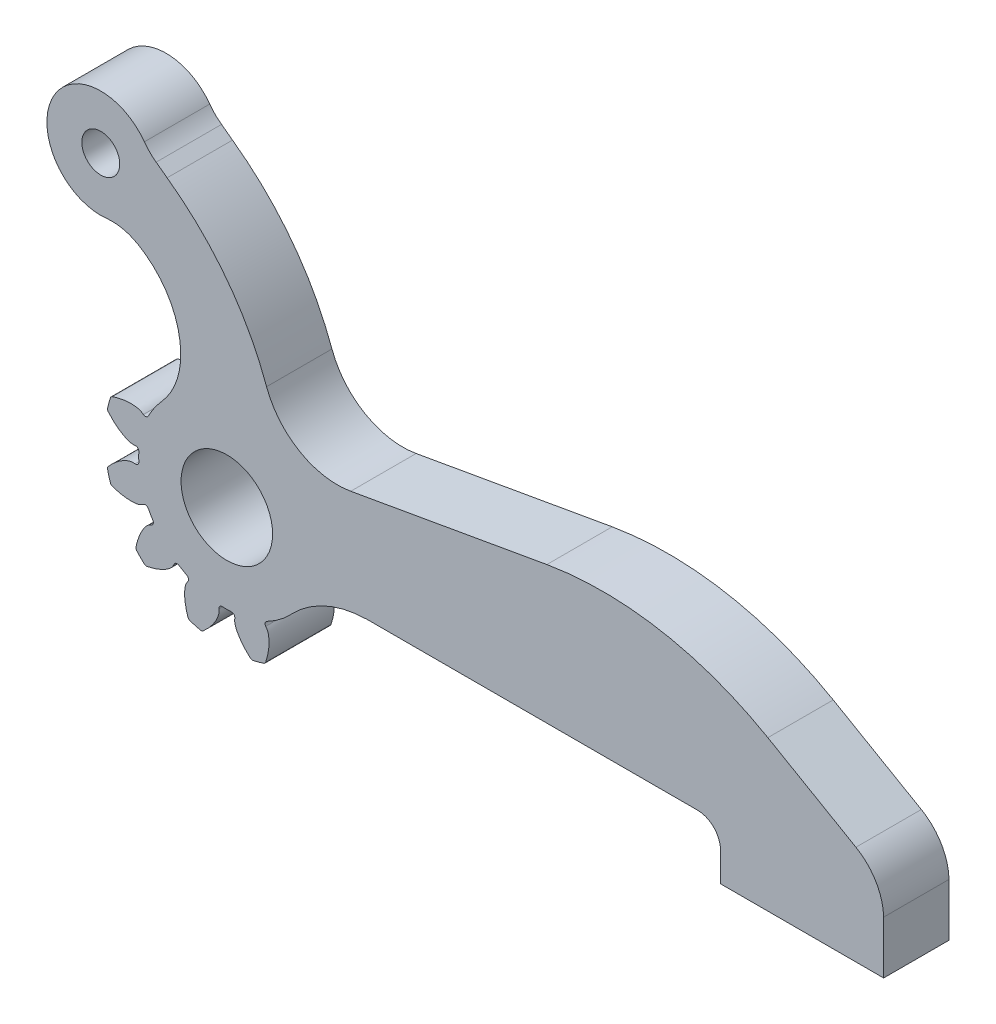
from build123d import *

# Parameters (mm, degrees)
ESQUISSE1_R        = 3.5
ESQUISSE1_R_2      = 1.45
BOSS_EXTRU_1_DEPTH = 5


with BuildPart() as part:
    # Esquisse1 → Boss.-Extru.1 (new body)
    with BuildSketch(Plane.XY):
        with BuildLine():
            Line((-23.520309347, 11.085383373), (-24.358908183, 11.706502475))
            ThreePointArc((-24.358908183, 11.706502475), (-24.845678879, 12.118284674), (-25.260449538, 12.602511471))
            ThreePointArc((-25.260449538, 12.602511471), (-32.357200459, 11.85890316), (-28.166092976, 6.083832163))
            ThreePointArc((-28.166092976, 6.083832163), (-26.925251175, 6.018420638), (-25.765053202, 5.573552451))
            ThreePointArc((-25.765053202, 5.573552451), (-23.38866031, 3.221956107), (-22.477205459, 0.005358743))
            ThreePointArc((-22.477205459, 0.005358743), (-22.840333933, -2.118823087), (-23.958742219, -3.960879992))
            ThreePointArc((-23.958742219, -3.960879992), (-24.504417424, -4.651802838), (-24.955377519, -5.407958113))
            ThreePointArc((-24.955377519, -5.407958113), (-25.122929262, -5.539522919), (-25.331723523, -5.497240048))
            add(Edge.make_bspline(
                [(-27.707778762, -5.50497209), (-27.463755153, -5.421858651), (-27.208964141, -5.35321212), (-26.847281922, -5.290646334), (-26.755999287, -5.277514723), (-26.472348923, -5.247412771), (-26.276940328, -5.237520804), (-25.988433148, -5.260972525), (-25.921846007, -5.267964485), (-25.794475247, -5.289589568), (-25.737903956, -5.299827616), (-25.600175401, -5.340785914), (-25.51525962, -5.375688947), (-25.386655187, -5.458237644), (-25.359770306, -5.476681289), (-25.331723523, -5.497240048)],
                knots=[0, 0, 0, 0, 0.401379624, 0.401379624, 0.532597126, 0.532597126, 0.795032129, 0.795032129, 0.872293172, 0.872293172, 0.929035383, 0.929035383, 0.985777595, 0.985777595, 1, 1, 1, 1], degree=3))
            ThreePointArc((-27.707778762, -5.50497209), (-27.801973044, -5.564338041), (-27.859240924, -5.659822431))
            ThreePointArc((-27.859240924, -5.659822431), (-27.97528469, -6.057416591), (-28.073587363, -6.459764521))
            ThreePointArc((-28.073587363, -6.459764521), (-28.071734795, -6.57109038), (-28.019843727, -6.669600257))
            add(Edge.make_bspline(
                [(-25.965992802, -7.864336487), (-26.163909603, -7.885982848), (-26.294618647, -7.863685821), (-26.490123672, -7.810689646), (-26.569333075, -7.776803309), (-26.723621302, -7.70842793), (-26.794279204, -7.672573545), (-27.014611477, -7.551431096), (-27.148381506, -7.461400071), (-27.399282552, -7.274477346), (-27.514428456, -7.1774816), (-27.765918403, -6.946352168), (-27.896967937, -6.810004535), (-28.019843727, -6.669600257)],
                knots=[0, 0, 0, 0, 0.081187854, 0.081187854, 0.177126147, 0.177126147, 0.27306444, 0.27306444, 0.491378598, 0.491378598, 0.709692757, 0.709692757, 1, 1, 1, 1], degree=3))
            ThreePointArc((-25.965992802, -7.864336487), (-25.764030643, -7.932116803), (-25.68471018, -8.12983162))
            ThreePointArc((-25.68471018, -8.12983162), (-25.693544809, -8.474793397), (-25.684712274, -8.819755228))
            ThreePointArc((-25.684712274, -8.819755228), (-25.764033937, -9.017469563), (-25.965996507, -9.085248653))
            add(Edge.make_bspline(
                [(-28.019854683, -10.279972417), (-27.850080758, -10.085982263), (-27.663748533, -9.899137116), (-27.381805435, -9.664112445), (-27.309318159, -9.607098819), (-27.078720715, -9.439204582), (-26.914437891, -9.332933591), (-26.652857483, -9.208989788), (-26.591695348, -9.181751432), (-26.470576489, -9.136793922), (-26.416465288, -9.117374686), (-26.2767097, -9.083981334), (-26.185718951, -9.071750358), (-26.033069896, -9.078937415), (-26.000565097, -9.081467639), (-25.965996507, -9.085248653)],
                knots=[0, 0, 0, 0, 0.401379627, 0.401379627, 0.532597128, 0.532597128, 0.79503213, 0.79503213, 0.872293173, 0.872293173, 0.929035387, 0.929035387, 0.985777601, 0.985777601, 1, 1, 1, 1], degree=3))
            ThreePointArc((-28.019854683, -10.279972417), (-28.071746349, -10.37848198), (-28.073599593, -10.489807828))
            ThreePointArc((-28.073599593, -10.489807828), (-27.975299362, -10.892156354), (-27.85925801, -11.289751218))
            ThreePointArc((-27.85925801, -11.289751218), (-27.801990645, -11.385236021), (-27.707796615, -11.444602537))
            add(Edge.make_bspline(
                [(-25.331741596, -11.452348942), (-25.492319392, -11.570053641), (-25.616665259, -11.616098371), (-25.812475663, -11.66795485), (-25.898016186, -11.678213122), (-26.065821398, -11.696142421), (-26.144940129, -11.700420563), (-26.396324695, -11.705674262), (-26.557188449, -11.694590122), (-26.867936486, -11.658160819), (-27.016153634, -11.631732992), (-27.349515039, -11.557314005), (-27.531181086, -11.504758257), (-27.707796615, -11.444602537)],
                knots=[0, 0, 0, 0, 0.081187854, 0.081187854, 0.177126146, 0.177126146, 0.273064438, 0.273064438, 0.491378592, 0.491378592, 0.709692747, 0.709692747, 1, 1, 1, 1], degree=3))
            ThreePointArc((-25.331741596, -11.452348942), (-25.122947078, -11.410067338), (-24.955396133, -11.541633161))
            ThreePointArc((-24.955396133, -11.541633161), (-24.790566257, -11.844796137), (-24.610436143, -12.139125579))
            ThreePointArc((-24.610436143, -12.139125579), (-24.58027355, -12.350012048), (-24.721288721, -12.509691746))
            add(Edge.make_bspline(
                [(-25.902620196, -14.571281964), (-25.852586741, -14.318394602), (-25.784640874, -14.063415847), (-25.657983326, -13.718906965), (-25.623714317, -13.633288078), (-25.50795819, -13.372588681), (-25.418820586, -13.19841389), (-25.254257211, -12.960285204), (-25.214908427, -12.906115029), (-25.132495175, -12.806621255), (-25.095343118, -12.762748102), (-24.991007907, -12.663950818), (-24.918323098, -12.607863109), (-24.78253161, -12.537762753), (-24.753116511, -12.52370159), (-24.721288721, -12.509691746)],
                knots=[0, 0, 0, 0, 0.401379624, 0.401379624, 0.532597126, 0.532597126, 0.795032129, 0.795032129, 0.872293171, 0.872293171, 0.929035385, 0.929035385, 0.985777599, 0.985777599, 1, 1, 1, 1], degree=3))
            ThreePointArc((-25.902620196, -14.571281964), (-25.898304915, -14.682539581), (-25.844246948, -14.779877216))
            ThreePointArc((-25.844246948, -14.779877216), (-25.557942188, -15.079171145), (-25.258649996, -15.365477722))
            ThreePointArc((-25.258649996, -15.365477722), (-25.16131269, -15.41953628), (-25.0500551, -15.423852235))
            add(Edge.make_bspline(
                [(-22.988457711, -14.242533274), (-23.068669813, -14.424757432), (-23.153334128, -14.526806272), (-23.296982674, -14.669620503), (-23.365933805, -14.72127469), (-23.502292735, -14.820704525), (-23.568672495, -14.863968871), (-23.783751076, -14.994210996), (-23.928605252, -15.065043729), (-24.215935615, -15.188869049), (-24.357509352, -15.240090455), (-24.683418279, -15.342322416), (-24.867023546, -15.387640821), (-25.0500551, -15.423852235)],
                knots=[0, 0, 0, 0, 0.081187854, 0.081187854, 0.177126148, 0.177126148, 0.273064442, 0.273064442, 0.49137861, 0.49137861, 0.709692777, 0.709692777, 1, 1, 1, 1], degree=3))
            ThreePointArc((-22.988457711, -14.242533274), (-22.828777157, -14.101519072), (-22.617890871, -14.131682944))
            ThreePointArc((-22.617890871, -14.131682944), (-22.323562523, -14.311814845), (-22.020400547, -14.476646561))
            ThreePointArc((-22.020400547, -14.476646561), (-21.88883574, -14.644198304), (-21.931118612, -14.852992566))
            add(Edge.make_bspline(
                [(-21.92338657, -17.229047804), (-22.006500009, -16.985024196), (-22.075146539, -16.730233184), (-22.137712326, -16.368550965), (-22.150843937, -16.27726833), (-22.180945889, -15.993617965), (-22.190837855, -15.798209371), (-22.167386135, -15.509702191), (-22.160394175, -15.44311505), (-22.138769092, -15.315744289), (-22.128531044, -15.259172998), (-22.087572745, -15.121444441), (-22.052669711, -15.036528659), (-21.970121013, -14.907924226), (-21.951677369, -14.881039346), (-21.931118612, -14.852992566)],
                knots=[0, 0, 0, 0, 0.401379624, 0.401379624, 0.532597126, 0.532597126, 0.795032129, 0.795032129, 0.872293171, 0.872293171, 0.929035384, 0.929035384, 0.985777596, 0.985777596, 1, 1, 1, 1], degree=3))
            ThreePointArc((-21.92338657, -17.229047804), (-21.864020619, -17.323242086), (-21.768536229, -17.380509967))
            ThreePointArc((-21.768536229, -17.380509967), (-21.370942069, -17.496553733), (-20.96859414, -17.594856406))
            ThreePointArc((-20.96859414, -17.594856406), (-20.85726828, -17.593003837), (-20.758758403, -17.541112769))
            add(Edge.make_bspline(
                [(-19.564022173, -15.487261844), (-19.542375812, -15.685178645), (-19.564672839, -15.815887691), (-19.617669014, -16.011392715), (-19.651555352, -16.090602119), (-19.719930731, -16.244890347), (-19.755785117, -16.31554825), (-19.87692757, -16.535880531), (-19.9669586, -16.669650565), (-20.153881335, -16.920551621), (-20.250877086, -17.035697529), (-20.482006514, -17.287187467), (-20.618354136, -17.418236989), (-20.758758403, -17.541112769)],
                knots=[0, 0, 0, 0, 0.081187854, 0.081187854, 0.177126148, 0.177126148, 0.273064442, 0.273064442, 0.491378611, 0.491378611, 0.70969278, 0.70969278, 1, 1, 1, 1], degree=3))
            ThreePointArc((-19.564022173, -15.487261844), (-19.496241857, -15.285299686), (-19.29852704, -15.205979223))
            ThreePointArc((-19.29852704, -15.205979223), (-18.953565263, -15.214813851), (-18.608603432, -15.205981317))
            ThreePointArc((-18.608603432, -15.205981317), (-18.410889097, -15.285302979), (-18.343110007, -15.48726555))
            add(Edge.make_bspline(
                [(-17.148386243, -17.541123726), (-17.342376397, -17.3713498), (-17.529221544, -17.185017576), (-17.764246214, -16.903074479), (-17.82125984, -16.830587203), (-17.989154077, -16.599989758), (-18.095425068, -16.435706934), (-18.219368872, -16.174126527), (-18.246607228, -16.112964392), (-18.291564738, -15.991845532), (-18.310983975, -15.93773433), (-18.344377327, -15.797978738), (-18.356608302, -15.706987985), (-18.349421244, -15.554338929), (-18.34689102, -15.521834135), (-18.343110007, -15.48726555)],
                knots=[0, 0, 0, 0, 0.401379626, 0.401379626, 0.532597128, 0.532597128, 0.79503213, 0.79503213, 0.872293172, 0.872293172, 0.929035388, 0.929035388, 0.985777604, 0.985777604, 1, 1, 1, 1], degree=3))
            ThreePointArc((-17.148386243, -17.541123726), (-17.04987668, -17.593015392), (-16.938550832, -17.594868636))
            ThreePointArc((-16.938550832, -17.594868636), (-16.536202306, -17.496568405), (-16.138607442, -17.380527052))
            ThreePointArc((-16.138607442, -17.380527052), (-16.043122704, -17.323259752), (-15.983756182, -17.22906583))
            add(Edge.make_bspline(
                [(-15.976009718, -14.853010638), (-15.858305019, -15.013588435), (-15.812260288, -15.137934302), (-15.76040381, -15.333744708), (-15.750145537, -15.419285233), (-15.732216239, -15.587090447), (-15.727938096, -15.666209179), (-15.722684398, -15.917593753), (-15.733768539, -16.078457512), (-15.770197846, -16.38920556), (-15.796625675, -16.537422713), (-15.871044662, -16.870784108), (-15.923600407, -17.052450142), (-15.983756182, -17.22906583)],
                knots=[0, 0, 0, 0, 0.081187854, 0.081187854, 0.177126148, 0.177126148, 0.273064442, 0.273064442, 0.491378605, 0.491378605, 0.709692768, 0.709692768, 1, 1, 1, 1], degree=3))
            ThreePointArc((-15.976009718, -14.853010638), (-16.018291322, -14.64421612), (-15.886725499, -14.476665176))
            ThreePointArc((-15.886725499, -14.476665176), (-15.583562523, -14.3118353), (-15.289233081, -14.131705185))
            ThreePointArc((-15.289233081, -14.131705185), (-14.630974378, -13.646175845), (-14.036377119, -13.084484329))
            ThreePointArc((-14.036377119, -13.084484329), (-11.382823106, -11.204809867), (-8.204887511, -10.515425843))
            Line((-8.204887511, -10.515425843), (17.04643759, -10.514813851))
            ThreePointArc((17.04643759, -10.514813851), (18.255496355, -10.99583891), (18.803660163, -12.175976463))
            Line((18.803660163, -12.175976463), (18.803660163, -14.514813851))
            Line((18.803660163, -14.514813851), (31.285246412, -14.514813851))
            Line((31.285246412, -14.514813851), (31.285258645, -10.483748772))
            ThreePointArc((31.285258645, -10.483748772), (30.693026835, -8.420856178), (29.166459934, -6.912261511))
            Line((29.166459934, -6.912261511), (22.428792847, -3.022240342))
            ThreePointArc((22.428792847, -3.022240342), (14.240952746, -0.032887143), (5.524515127, -0.006939391))
            Line((5.524515127, -0.006939391), (-9.47465467, -2.651398118))
            ThreePointArc((-9.47465467, -2.651398118), (-13.371139001, -1.975728488), (-15.913565792, 1.053328395))
            ThreePointArc((-15.913565792, 1.053328395), (-18.956552603, 6.645913075), (-23.520309347, 11.085383373))
        make_face()
        with Locations((-18.953544809, -8.474813851)):
            Circle(ESQUISSE1_R, mode=Mode.SUBTRACT)
        with Locations((-28.594110039, 10.181539009)):
            Circle(ESQUISSE1_R_2, mode=Mode.SUBTRACT)
    extrude(amount=BOSS_EXTRU_1_DEPTH)


solid = part.part
